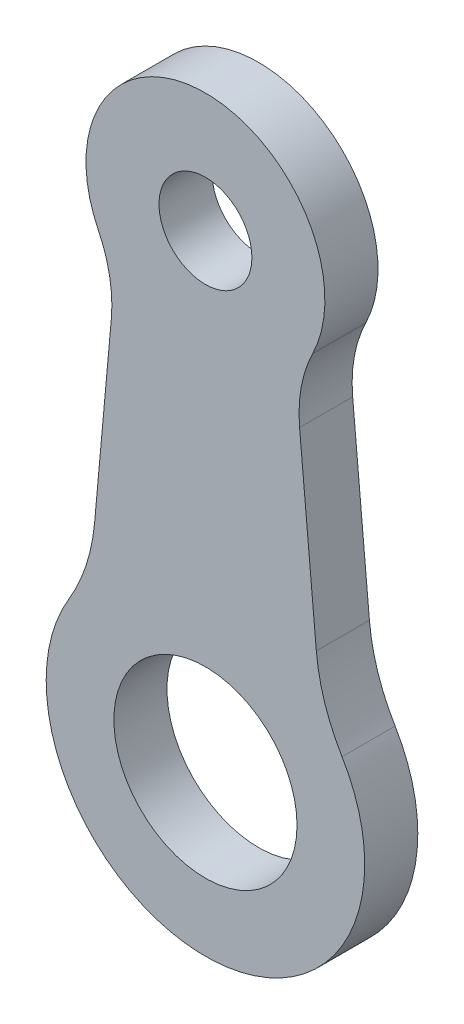
from build123d import *

# Parameters (mm, degrees)
SKETCH1_R           = 1.75
SKETCH1_R_2         = 3.45
BOSS_EXTRUDE1_DEPTH = 2


with BuildPart() as part:
    # Sketch1 → Boss-Extrude1 (new body)
    with BuildSketch(Plane.XY):
        with BuildLine():
            Line((-3.545417743, 13.027011553), (-4.176634672, 6.056009592))
            ThreePointArc((-4.176634672, 6.056009592), (-4.493207513, 4.516501974), (-5.145282945, 3.086432151))
            ThreePointArc((-5.145282945, 3.086432151), (0, -6), (5.145282945, 3.086432151))
            ThreePointArc((5.145282945, 3.086432151), (4.493207513, 4.516501974), (4.176634672, 6.056009592))
            Line((4.176634672, 6.056009592), (3.545417743, 13.027011553))
            ThreePointArc((3.545417743, 13.027011553), (3.608859175, 14.389566924), (4.038179283, 15.684273917))
            ThreePointArc((4.038179283, 15.684273917), (0, 22.17), (-4.038179283, 15.684273917))
            ThreePointArc((-4.038179283, 15.684273917), (-3.608859175, 14.389566924), (-3.545417743, 13.027011553))
        make_face()
        with Locations((0, 17.67)):
            Circle(SKETCH1_R, mode=Mode.SUBTRACT)
        Circle(SKETCH1_R_2, mode=Mode.SUBTRACT)
    extrude(amount=BOSS_EXTRUDE1_DEPTH)


solid = part.part
